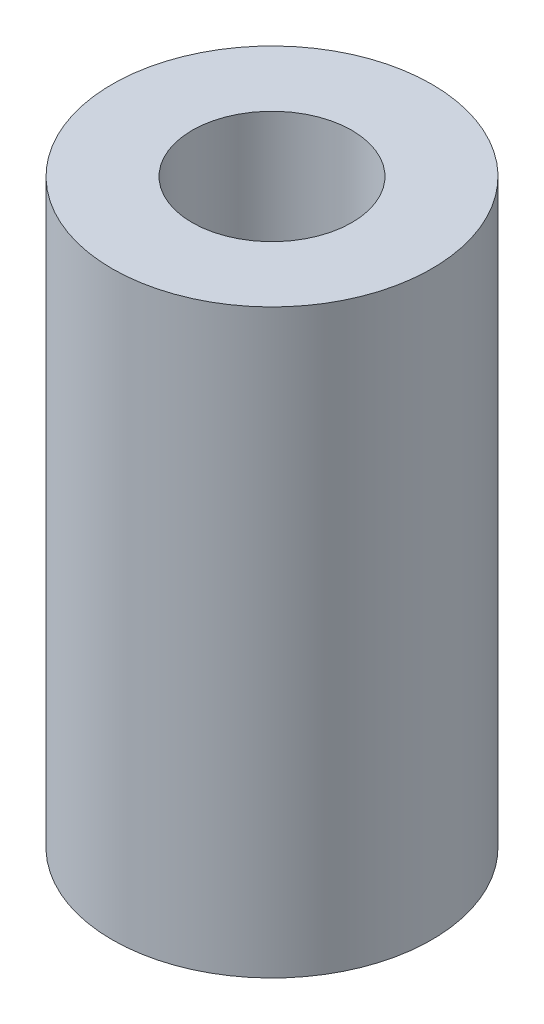
from build123d import *

# Parameters (mm, degrees)
SKETCH1_R           = 2.75
SKETCH1_R_2         = 1.375
BOSS_EXTRUDE1_DEPTH = 10


with BuildPart() as part:
    # Sketch1 → Boss-Extrude1 (new body)
    with BuildSketch(Plane(origin=(0, 0, 0), x_dir=(1, 0, 0), z_dir=(0, 1, 0))):
        with Locations(Location((0, 0, 0), (0, 0, 270))):
            Circle(SKETCH1_R)
        with Locations(Location((0, 0, 0), (0, 0, 270))):
            Circle(SKETCH1_R_2, mode=Mode.SUBTRACT)
    extrude(amount=BOSS_EXTRUDE1_DEPTH)


solid = part.part
